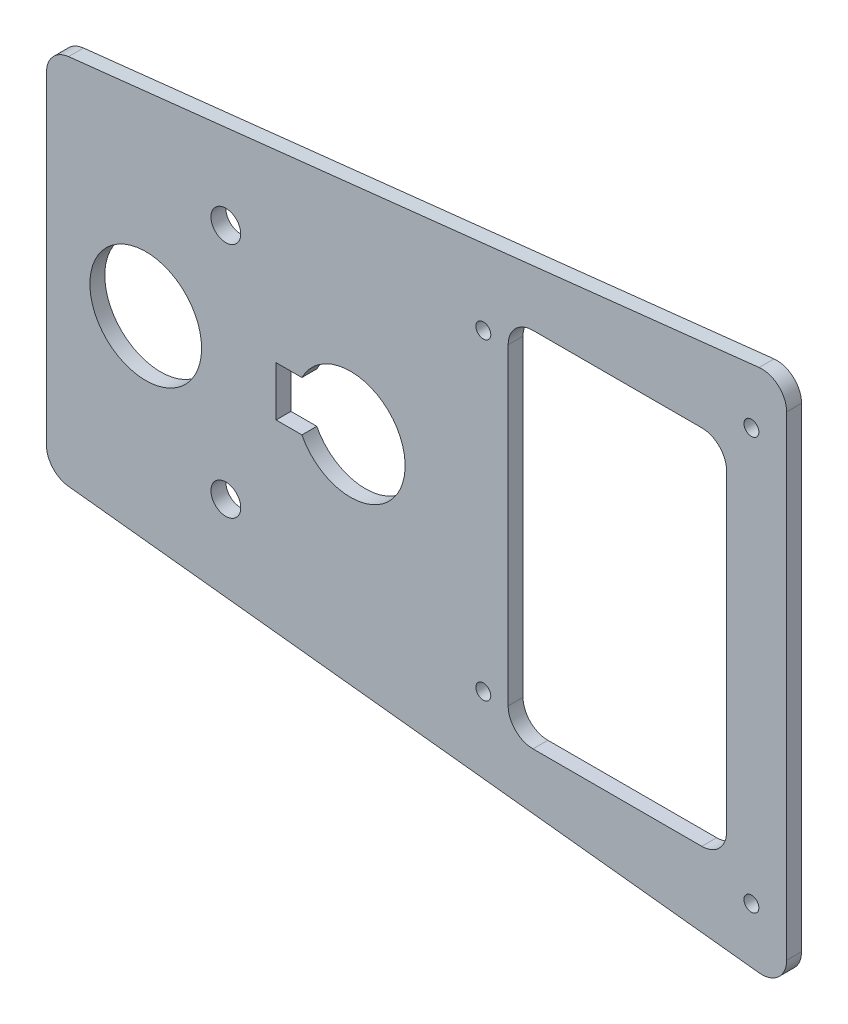
from build123d import *

# Parameters (mm, degrees)
BOSS_EXTRUDE1_DEPTH = 1.5
FILLET1_R           = 5
SKETCH2_R           = 11.25
SKETCH2_R_2         = 1.5
CUT_EXTRUDE1_DEPTH  = 3
FILLET2_R           = 5
CUT_EXTRUDE2_REACH  = 160.212
SKETCH3_R           = 3


with BuildPart() as part:
    # Sketch1 → Boss-Extrude1 (new, symmetric)
    with BuildSketch(Plane(origin=(0, 0, 0), x_dir=(0, 1, 0), z_dir=(0, 0, 1))):
        Polygon((53.415, 0), (-53.415, 0), (-37, 149.099120638), (37, 149.099120638), align=None)
    extrude(amount=BOSS_EXTRUDE1_DEPTH, both=True)

    # Fillet1
    fillet1_edges = [part.edges().sort_by_distance(p)[0] for p in [
        (-149.099120638, -37, 0),
        (-149.099120638, 37, 0),
        (0, 53.415, 0),
        (0, -53.415, 0),
    ]]
    fillet(fillet1_edges, radius=FILLET1_R)

    # Sketch2 → Cut-Extrude1 (cut)
    with BuildSketch(Plane.XY.offset(1.5)):
        with Locations((-129.099120638, 0)):
            Circle(SKETCH2_R)
        Polygon((-56.099120638, 36.5), (-56.099120638, 0), (-56.099120638, -36.5), (-12.099120638, -36.5), (-12.099120638, 36.5), align=None)
        with BuildLine():
            Line((-102.849120638, 5), (-102.849120638, -5))
            Line((-102.849120638, -5), (-97.647079609, -5))
            ThreePointArc((-97.647079609, -5), (-76.849120638, 0), (-97.647079609, 5))
            Line((-97.647079609, 5), (-102.849120638, 5))
        make_face()
        with Locations((-7.099120638, 41.5)):
            Circle(SKETCH2_R_2)
        with Locations((-7.099120638, -41.5)):
            Circle(SKETCH2_R_2)
        with Locations((-61.099120638, -31.5)):
            Circle(SKETCH2_R_2)
        with Locations(Location((-61.099120638, 31.5, 0), (0, 0, 180))):
            Circle(SKETCH2_R_2)
    extrude(amount=-CUT_EXTRUDE1_DEPTH, mode=Mode.SUBTRACT)

    # Fillet2
    fillet2_edges = [part.edges().sort_by_distance(p)[0] for p in [
        (-56.099120638, -36.5, 0),
        (-56.099120638, 36.5, 0),
        (-12.099120638, 36.5, 0),
        (-12.099120638, -36.5, 0),
    ]]
    fillet(fillet2_edges, radius=FILLET2_R)

    # Sketch3 → Cut-Extrude2 (cut, up to next)
    with BuildSketch(Plane.XY.offset(1.5), mode=Mode.PRIVATE) as cut_extrude2_sk1:
        with Locations((-112.96609651, -23.875332325)):
            Circle(SKETCH3_R)
    cut_extrude2_tool1 = extrude(cut_extrude2_sk1.sketch, amount=-CUT_EXTRUDE2_REACH, mode=Mode.PRIVATE) & part.part
    # Sketch3 → Cut-Extrude2 (cut, up to next)
    with BuildSketch(Plane.XY.offset(1.5), mode=Mode.PRIVATE) as cut_extrude2_sk2:
        with Locations((-112.96609651, 23.875332325)):
            Circle(SKETCH3_R)
    cut_extrude2_tool2 = extrude(cut_extrude2_sk2.sketch, amount=-CUT_EXTRUDE2_REACH, mode=Mode.PRIVATE) & part.part
    add(cut_extrude2_tool1.solids().sort_by_distance((-112.966097, -23.875332, 1.5))[0], mode=Mode.SUBTRACT)
    add(cut_extrude2_tool2.solids().sort_by_distance((-112.966097, 23.875332, 1.5))[0], mode=Mode.SUBTRACT)


solid = part.part
